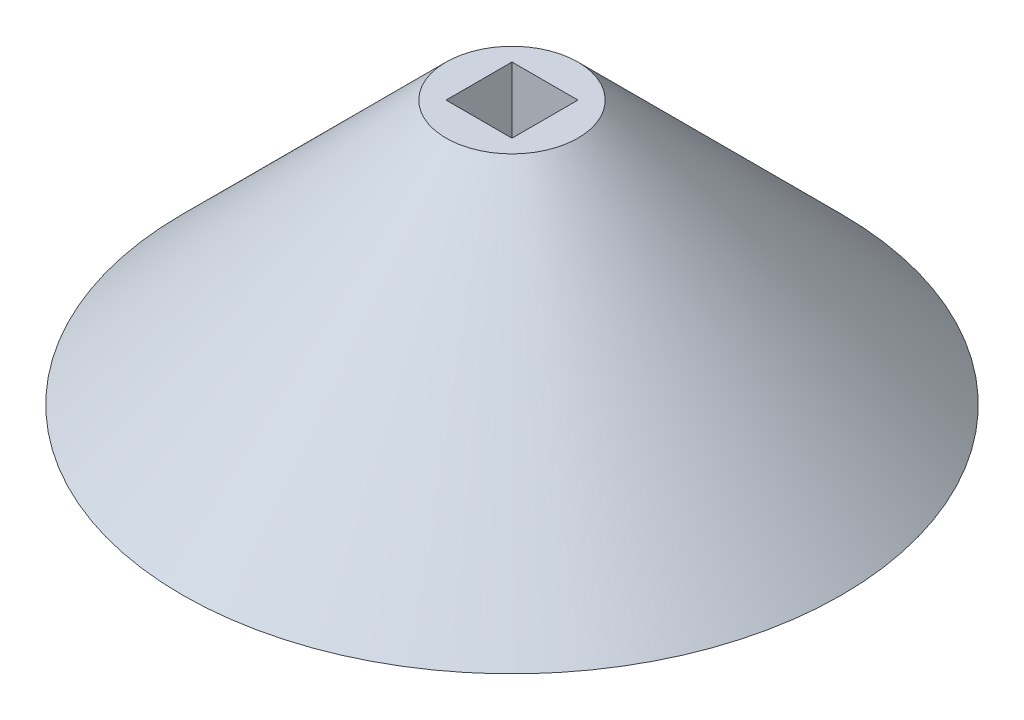
from build123d import *

# Parameters (mm, degrees)
SKETCH2_R          = 1.5
CUT_EXTRUDE1_DEPTH = 41.620192023
CUT_EXTRUDE2_START = 10
SKETCH3_W          = 5
SKETCH3_H          = 5
CUT_EXTRUDE2_DEPTH = 31.620192023
SKETCH4_R          = 13.1
CUT_EXTRUDE3_DEPTH = 7.9


with BuildPart() as part:
    # Sketch1 → Revolve1 (revolve)
    with BuildSketch(Plane(origin=(0, 0, 0), x_dir=(0, 0, -1), z_dir=(1, 0, 0))):
        Polygon((0, 0), (25, 0), (5, 20), (0, 20), align=None)
    revolve(axis=Axis((0, 0, 0), (0, 1, 0)))

    # Sketch2 → Cut-Extrude1 (cut, through all)
    with BuildSketch(Plane(origin=(0, 0, 0), x_dir=(1, 0, 0), z_dir=(0, 1, 0))):
        with Locations(Location((0, 0, 0), (0, 0, 270))):
            Circle(SKETCH2_R)
    extrude(amount=CUT_EXTRUDE1_DEPTH, mode=Mode.SUBTRACT)

    # Sketch3 → Cut-Extrude2 (cut, through all)
    with BuildSketch(Plane(origin=(0, 0, 0), x_dir=(1, 0, 0), z_dir=(0, 1, 0)).offset(CUT_EXTRUDE2_START)):
        Rectangle(SKETCH3_W, SKETCH3_H)
    extrude(amount=CUT_EXTRUDE2_DEPTH, mode=Mode.SUBTRACT)

    # Sketch4 → Cut-Extrude3 (cut)
    with BuildSketch(Plane(origin=(0, 0, 0), x_dir=(1, 0, 0), z_dir=(0, 1, 0))):
        with Locations(Location((0, 0, 0), (0, 0, 270))):
            Circle(SKETCH4_R)
    extrude(amount=CUT_EXTRUDE3_DEPTH, mode=Mode.SUBTRACT)


solid = part.part
